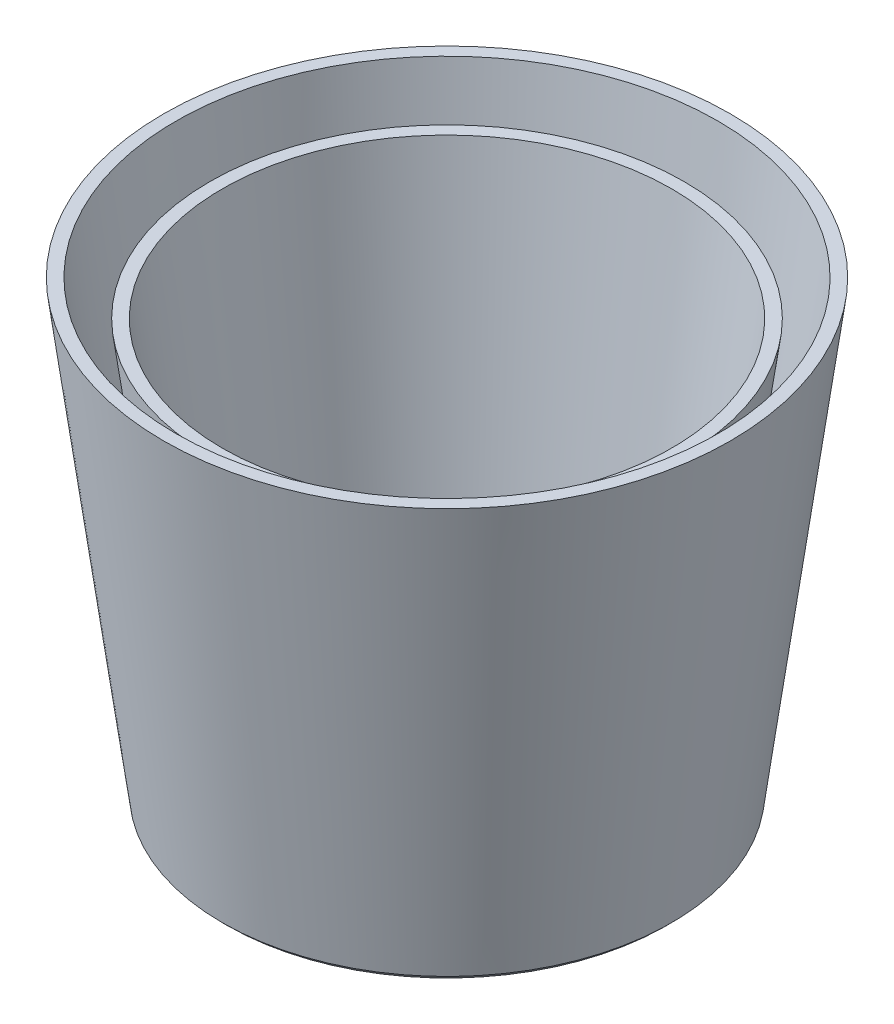
from build123d import *

# Parameters (mm, degrees)
SKETCH2_R                = 5
BOSS_EXTRUDE1_DEPTH      = 13
FILLET3_R                = 3
CIRPATTERN2_COUNT        = 5
FILLET3_OF_CIRPATTERN2_R = 3
SKETCH3_R                = 4
CUT_EXTRUDE1_DEPTH       = 10
SKETCH4_R                = 2.5
CUT_EXTRUDE2_DEPTH       = 10
CIRPATTERN3_COUNT        = 5
FILLET4_R                = 3
CHAMFER2_SIZE            = 1
CHAMFER2_SIZE2           = 1.161440479


with BuildPart() as part:
    # Sketch1 → Revolve2 (revolve)
    with BuildSketch(Plane(origin=(0, 0, 0), x_dir=(0, 0, -1), z_dir=(1, 0, 0)), mode=Mode.PRIVATE) as revolve2_sk:
        Polygon((0, -95), (40, -95), (51.578947368, -7), (54.604805457, -7), (42.631121247, -98), (0, -98), (0, -105), (48.770404156, -105), (62.58619363, 0), (62.803387034, 1.650669871), (65.829245123, 1.650669871), (65.440401044, -1.304545126), (51.401525403, -108), (0, -108), (-3, -108), (-3, -95), align=None)
    revolve(revolve2_sk.sketch.rotate(Axis((0, -95, 3), (0, -1, 0)), 180), axis=Axis((0, -95, 3), (0, -1, 0)))

    # Sketch2 → Boss-Extrude1 (add)
    with BuildSketch(Plane.XZ.offset(108)):
        with Locations(Location((0, 35, 0), (0, 0, 270))):
            Circle(SKETCH2_R)
    boss_extrude1 = extrude(amount=-BOSS_EXTRUDE1_DEPTH)

    # Fillet3
    fillet3_edges = [part.edges().sort_by_distance(p)[0] for p in [
        (0, -105, 40),
        (0, -98, 40),
    ]]
    fillet(fillet3_edges, radius=FILLET3_R)

    # CirPattern2: Boss-Extrude1 ×5 about axis
    cirpattern2_axis = Axis((0, 0, 3), (0, 1, 0))
    for i in range(1, CIRPATTERN2_COUNT):
        add(boss_extrude1.rotate(cirpattern2_axis, i * 360 / CIRPATTERN2_COUNT))

    # Fillet3 of CirPattern2
    fillet3_of_cirpattern2_edges = [part.edges().sort_by_distance(p)[0] for p in [
        (35.189091103, -105, 14.433628792),
        (35.189091103, -98, 14.433628792),
        (21.748054335, -105, -26.933628792),
        (21.748054335, -98, -26.933628792),
        (-21.748054335, -105, -26.933628792),
        (-21.748054335, -98, -26.933628792),
        (-35.189091103, -105, 14.433628792),
        (-35.189091103, -98, 14.433628792),
    ]]
    fillet(fillet3_of_cirpattern2_edges, radius=FILLET3_OF_CIRPATTERN2_R)

    # Sketch3 → Cut-Extrude1 (cut)
    with BuildSketch(Plane(origin=(0, -95, 0), x_dir=(1, 0, 0), z_dir=(0, 1, 0))):
        with Locations(Location((0, -3.161501371, 0), (0, 0, 270))):
            Circle(SKETCH3_R)
    extrude(amount=-CUT_EXTRUDE1_DEPTH, mode=Mode.SUBTRACT)

    # Sketch4 → Cut-Extrude2 (cut)
    with BuildSketch(Plane(origin=(0, -95, 0), x_dir=(1, 0, 0), z_dir=(0, 1, 0))):
        with Locations(Location((0, 30, 0), (0, 0, 270))):
            Circle(SKETCH4_R)
    cut_extrude2 = extrude(amount=-CUT_EXTRUDE2_DEPTH, mode=Mode.SUBTRACT)

    # CirPattern3: Cut-Extrude2 ×5 about axis
    cirpattern3_axis = Axis((0, 0, 3), (0, 1, 0))
    for i in range(1, CIRPATTERN3_COUNT):
        add(cut_extrude2.rotate(cirpattern3_axis, i * 360 / CIRPATTERN3_COUNT), mode=Mode.SUBTRACT)

    # Fillet4
    fillet4_edges = [part.edges().sort_by_distance(p)[0] for p in [
        (0, -95, -40),
    ]]
    fillet(fillet4_edges, radius=FILLET4_R)

    # Chamfer2
    chamfer2_edges = [part.edges().sort_by_distance(p)[0] for p in [
        (0, -108, -51.401525403),
    ]]
    chamfer2_side = [part.faces().sort_by_distance(p)[0] for p in [
        (0, -108, 3),
    ]]
    chamfer(chamfer2_edges, length=CHAMFER2_SIZE, length2=CHAMFER2_SIZE2, reference=chamfer2_side[0])


solid = part.part
